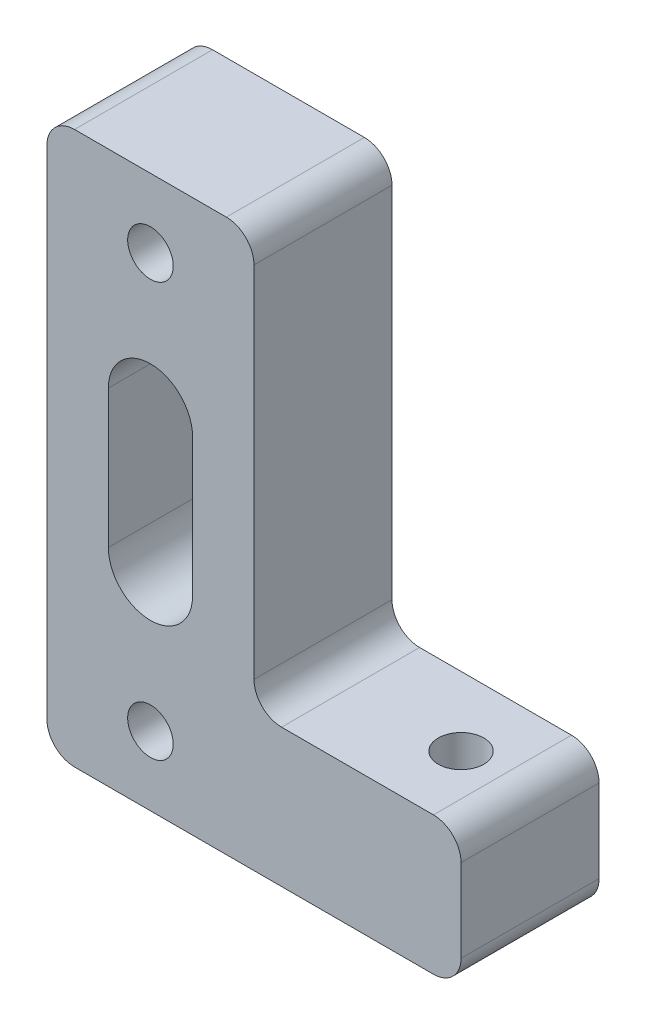
from build123d import *

# Parameters (mm, degrees)
SKETCH_1_R          = 1.65
EXTRUDE_1_DEPTH     = 10
SKETCH_5_R          = 1.65
CUT_EXTRUDE_2_DEPTH = 10
BODY_CUT_DEPTH      = 10
FILLET_1_R          = 2
FILLET_2_R          = 2


with BuildPart() as part:
    # ｽｹｯﾁ1 → ﾎﾞｽ - 押し出し1 (new body)
    with BuildSketch(Plane.XY):
        Polygon((0, 0), (0, -40), (30, -40), (30, -30), (15, -30), (15, 0), align=None)
        with Locations((7.5, -5)):
            Circle(SKETCH_1_R, mode=Mode.SUBTRACT)
        with Locations((7.5, -35)):
            Circle(SKETCH_1_R, mode=Mode.SUBTRACT)
    extrude(amount=EXTRUDE_1_DEPTH)

    # ｽｹｯﾁ5 → ｶｯﾄ - 押し出し2 (cut)
    with BuildSketch(Plane.XZ.offset(40)):
        with Locations(Location((25, 5, 0), (0, 0, 270))):
            Circle(SKETCH_5_R)
    extrude(amount=-CUT_EXTRUDE_2_DEPTH, mode=Mode.SUBTRACT)

    # ｽｹｯﾁ7 → body cut (cut)
    with BuildSketch(Plane.XY.offset(10)):
        with BuildLine():
            Line((10.55, -15), (10.55, -25))
            ThreePointArc((10.55, -25), (7.5, -28.05), (4.45, -25))
            Line((4.45, -25), (4.45, -15))
            ThreePointArc((4.45, -15), (7.5, -11.95), (10.55, -15))
        make_face()
    extrude(amount=-BODY_CUT_DEPTH, mode=Mode.SUBTRACT)

    # ﾌｨﾚｯﾄ1
    fillet_1_edges = [part.edges().sort_by_distance(p)[0] for p in [
        (15, -30, 5),
    ]]
    fillet(fillet_1_edges, radius=FILLET_1_R)

    # ﾌｨﾚｯﾄ2
    fillet_2_edges = [part.edges().sort_by_distance(p)[0] for p in [
        (15, 0, 5),
        (30, -30, 5),
        (30, -40, 5),
        (0, -40, 5),
        (0, 0, 5),
    ]]
    fillet(fillet_2_edges, radius=FILLET_2_R)


solid = part.part
